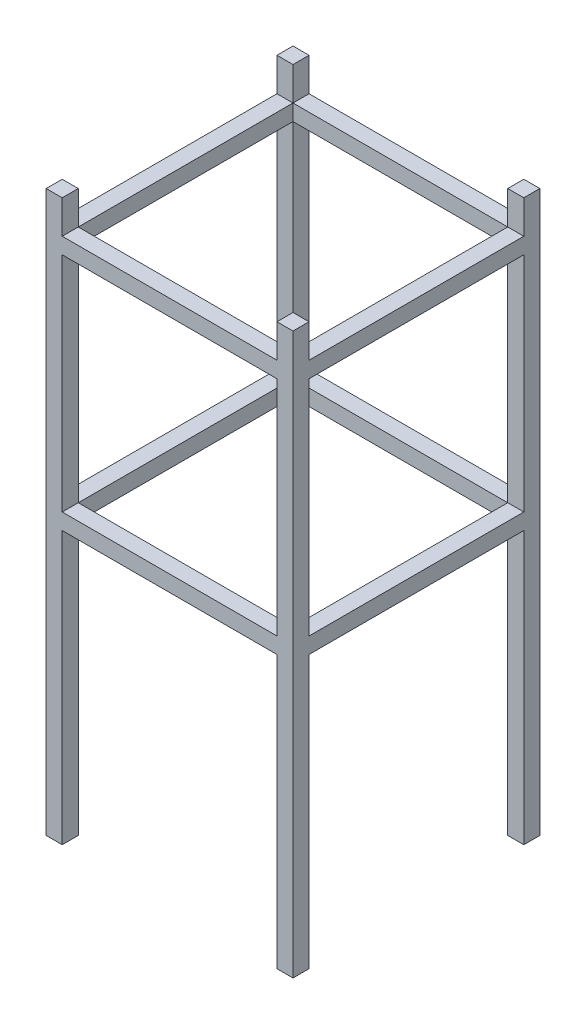
from build123d import *

# Parameters (mm, degrees)
SKETCH3_W                = 6.5
SKETCH3_H                = 6.5
BOSS_EXTRUDE1_DEPTH      = 200
BOSS_EXTRUDE1_2_DEPTH    = 200
BOSS_EXTRUDE1_3_DEPTH    = 200
BOSS_EXTRUDE1_4_DEPTH    = 200
SKETCH11_W               = 100
SKETCH11_H               = 100
SKETCH11_W_2             = 87
SKETCH11_H_2             = 87
BOSS_EXTRUDE7_DEPTH      = 6.5
BOSS_EXTRUDE8_DEPTH      = 3.25
BOSS_EXTRUDE8_DEPTH_BACK = 3.25
BOSS_EXTRUDE8_START      = -100
SKETCH12_W               = 100
SKETCH12_H               = 100
SKETCH12_W_2             = 87
SKETCH12_H_2             = 87
SKETCH13_W               = 6.5
SKETCH13_H               = 6.5
BOSS_EXTRUDE9_DEPTH      = 13.5
SKETCH14_W               = 6.5
SKETCH14_H               = 6.5
BOSS_EXTRUDE10_DEPTH     = 13.5


with BuildPart() as part:
    # Sketch3 → Boss-Extrude1 (new body)
    with BuildSketch(Plane(origin=(0, 0, 0), x_dir=(1, 0, 0), z_dir=(0, 1, 0))):
        with Locations((-46.75, 46.75)):
            Rectangle(SKETCH3_W, SKETCH3_H)
    extrude(amount=BOSS_EXTRUDE1_DEPTH)



with BuildPart() as body_2:
    # Sketch3 → Boss-Extrude1 2 (new body)
    with BuildSketch(Plane(origin=(0, 0, 0), x_dir=(1, 0, 0), z_dir=(0, 1, 0))):
        with Locations((46.75, 46.75)):
            Rectangle(SKETCH3_W, SKETCH3_H)
    extrude(amount=BOSS_EXTRUDE1_2_DEPTH)


with BuildPart() as body_3:
    # Sketch3 → Boss-Extrude1 3 (new body)
    with BuildSketch(Plane(origin=(0, 0, 0), x_dir=(1, 0, 0), z_dir=(0, 1, 0))):
        with Locations((46.75, -46.75)):
            Rectangle(SKETCH3_W, SKETCH3_H)
    extrude(amount=BOSS_EXTRUDE1_3_DEPTH)


with BuildPart() as body_4:
    # Sketch3 → Boss-Extrude1 4 (new body)
    with BuildSketch(Plane(origin=(0, 0, 0), x_dir=(1, 0, 0), z_dir=(0, 1, 0))):
        with Locations((-46.75, -46.75)):
            Rectangle(SKETCH3_W, SKETCH3_H)
    extrude(amount=BOSS_EXTRUDE1_4_DEPTH)


with BuildPart() as part_1:
    add(part.part)

    add(body_2.part)  # Boss-Extrude7 merges body 2

    add(body_3.part)  # Boss-Extrude7 merges body 3

    add(body_4.part)  # Boss-Extrude7 merges body 4
    # Sketch11 → Boss-Extrude7 (add)
    with BuildSketch(Plane(origin=(0, 200, 0), x_dir=(1, 0, 0), z_dir=(0, 1, 0))):
        Rectangle(SKETCH11_W, SKETCH11_H)
        Rectangle(SKETCH11_W_2, SKETCH11_H_2, mode=Mode.SUBTRACT)
    extrude(amount=-BOSS_EXTRUDE7_DEPTH)

    # Sketch12 → Boss-Extrude8 (add, two sides: drawn at the far end of the back side and taken through both)
    with BuildSketch(Plane(origin=(0, 200, 0), x_dir=(1, 0, 0), z_dir=(0, 1, 0)).offset(BOSS_EXTRUDE8_START - BOSS_EXTRUDE8_DEPTH_BACK)):
        Rectangle(SKETCH12_W, SKETCH12_H)
        Rectangle(SKETCH12_W_2, SKETCH12_H_2, mode=Mode.SUBTRACT)
    extrude(amount=BOSS_EXTRUDE8_DEPTH + BOSS_EXTRUDE8_DEPTH_BACK)

    # Sketch13 → Boss-Extrude9 (add)
    with BuildSketch(Plane(origin=(0, 200, 0), x_dir=(1, 0, 0), z_dir=(0, 1, 0))):
        with Locations((-46.75, 46.75)):
            Rectangle(SKETCH13_W, SKETCH13_H)
        with Locations((46.75, 46.75)):
            Rectangle(SKETCH13_W, SKETCH13_H)
        with Locations((46.75, -46.75)):
            Rectangle(SKETCH13_W, SKETCH13_H)
        with Locations((-46.75, -46.75)):
            Rectangle(SKETCH13_W, SKETCH13_H)
    extrude(amount=BOSS_EXTRUDE9_DEPTH)

    # Sketch14 → Boss-Extrude10 (add)
    with BuildSketch(Plane.XZ):
        with Locations((-46.75, 46.75)):
            Rectangle(SKETCH14_W, SKETCH14_H)
        with Locations((46.75, 46.75)):
            Rectangle(SKETCH14_W, SKETCH14_H)
        with Locations((46.75, -46.75)):
            Rectangle(SKETCH14_W, SKETCH14_H)
        with Locations((-46.75, -46.75)):
            Rectangle(SKETCH14_W, SKETCH14_H)
    extrude(amount=BOSS_EXTRUDE10_DEPTH)


solid = part_1.part
